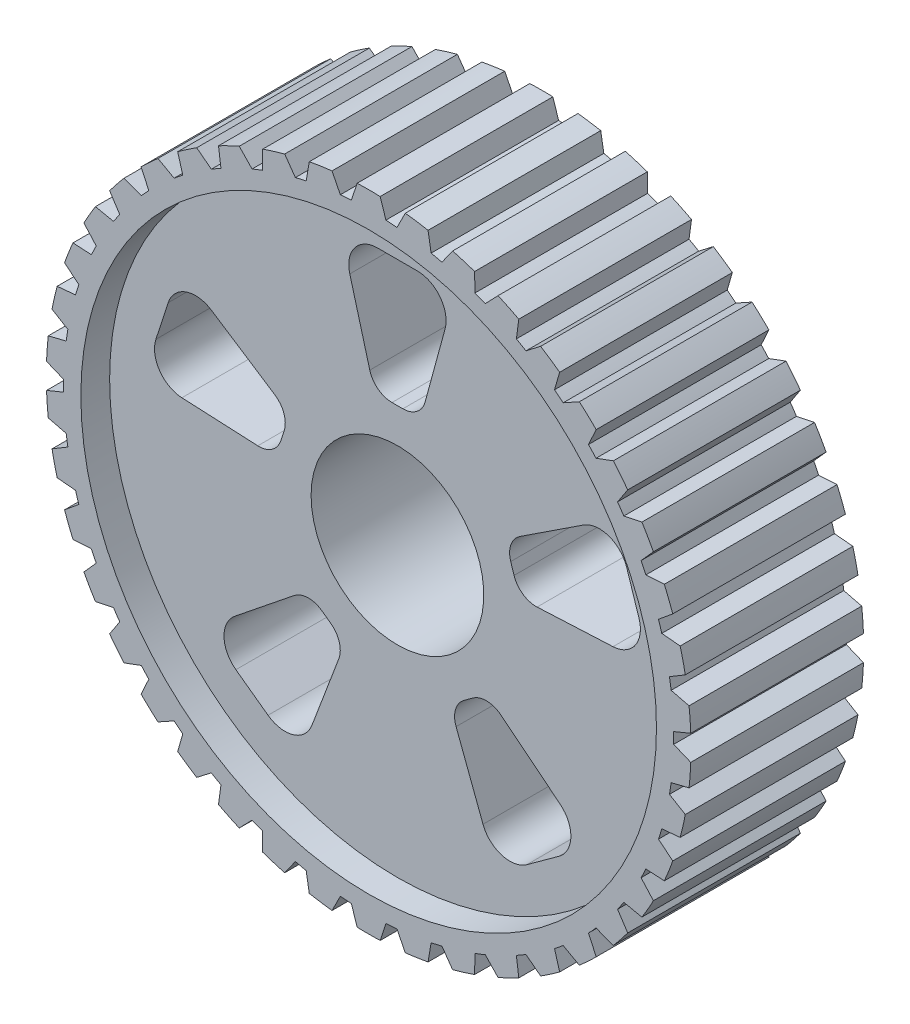
from build123d import *

# Parameters (mm, degrees)
SKETCH_1_R      = 50
EXTRUDE_1_DEPTH = 15
SKETCH_2_R      = 50
SKETCH_2_R_2    = 15
EXTRUDE_2_DEPTH = 25


with BuildPart() as part:
    # Эскиз1 → Бобышка-Вытянуть1 (new, symmetric)
    with BuildSketch(Plane.XY):
        with BuildLine():
            ThreePointArc((2, 55.964274319), (0, 56), (-2, 55.964274319))
            Line((-2, 55.964274319), (-3, 52.915026221))
            ThreePointArc((-3, 52.915026221), (-3.478337142, 52.885736931), (-3.956389894, 52.852123694))
            ThreePointArc((-3.956389894, 52.852123694), (-3.96069496, 52.851801251), (-3.965, 52.851478456))
            ThreePointArc((-3.965, 52.851478456), (-4.442723091, 52.813466195), (-4.920082944, 52.771135897))
            Line((-4.920082944, 52.771135897), (-6.363380617, 55.637284146))
            ThreePointArc((-6.363380617, 55.637284146), (-8.346366906, 55.374526269), (-10.318703922, 55.041115081))
            Line((-10.318703922, 55.041115081), (-10.853067901, 51.8768823))
            ThreePointArc((-10.853067901, 51.8768823), (-11.32169707, 51.776627695), (-11.789400575, 51.672139825))
            ThreePointArc((-11.789400575, 51.672139825), (-11.7936095, 51.671179346), (-11.797818346, 51.670218524))
            ThreePointArc((-11.797818346, 51.670218524), (-12.264540231, 51.561429896), (-12.730259365, 51.448425598))
            Line((-12.730259365, 51.448425598), (-14.584613826, 54.067448983))
            ThreePointArc((-14.584613826, 54.067448983), (-16.506289767, 53.512077124), (-18.406905049, 52.888428286))
            Line((-18.406905049, 52.888428286), (-18.4636962, 49.679894551))
            ThreePointArc((-18.4636962, 49.679894551), (-18.912148995, 49.510914154), (-19.359055529, 49.337885737))
            ThreePointArc((-19.359055529, 49.337885737), (-19.363074291, 49.336308678), (-19.367092925, 49.334731292))
            ThreePointArc((-19.367092925, 49.334731292), (-19.812387809, 49.157596456), (-20.256062829, 48.976442487))
            Line((-20.256062829, 48.976442487), (-22.480050863, 51.289836354))
            ThreePointArc((-22.480050863, 51.289836354), (-24.297489391, 50.454256603), (-26.083926334, 49.554301398))
            Line((-26.083926334, 49.554301398), (-25.661876036, 46.373140052))
            ThreePointArc((-25.661876036, 46.373140052), (-26.080134762, 46.139208606), (-26.496261172, 45.901504811))
            ThreePointArc((-26.496261172, 45.901504811), (-26.5, 45.899346401), (-26.503738652, 45.897187686))
            ThreePointArc((-26.503738652, 45.897187686), (-26.917659382, 45.655663541), (-27.32937932, 45.410406582))
            Line((-27.32937932, 45.410406582), (-29.87332071, 47.366493535))
            ThreePointArc((-29.87332071, 47.366493535), (-31.545923252, 46.269371362), (-33.178275807, 45.113213302))
            Line((-33.178275807, 45.113213302), (-32.286811966, 42.030486234))
            ThreePointArc((-32.286811966, 42.030486234), (-32.665533415, 41.73682938), (-33.041584125, 41.439760117))
            ThreePointArc((-33.041584125, 41.439760117), (-33.044959499, 41.437068571), (-33.048334653, 41.43437675))
            ThreePointArc((-33.048334653, 41.43437675), (-33.421634925, 41.133858547), (-33.792202639, 40.829977233))
            Line((-33.792202639, 40.829977233), (-36.599269937, 42.38506152))
            ThreePointArc((-36.599269937, 42.38506152), (-38.089673315, 41.050904822), (-39.531477424, 39.664370569))
            Line((-39.531477424, 39.664370569), (-38.19051387, 36.748940806))
            ThreePointArc((-38.19051387, 36.748940806), (-38.52123803, 36.402118354), (-38.848812688, 36.052319659))
            ThreePointArc((-38.848812688, 36.052319659), (-38.851749207, 36.049155102), (-38.854685469, 36.045990306))
            ThreePointArc((-38.854685469, 36.045990306), (-39.179026371, 35.693191124), (-39.50016399, 35.337473661))
            Line((-39.50016399, 35.337473661), (-42.507651952, 36.456817271))
            ThreePointArc((-42.507651952, 36.456817271), (-43.782563018, 34.915428904), (-45.001611159, 33.329491341))
            Line((-45.001611159, 33.329491341), (-43.241102801, 30.646484767))
            ThreePointArc((-43.241102801, 30.646484767), (-43.516441841, 30.254244156), (-43.788222971, 29.859529954))
            ThreePointArc((-43.788222971, 29.859529954), (-43.790655039, 29.855963077), (-43.793086816, 29.852396003))
            ThreePointArc((-43.793086816, 29.852396003), (-44.061223109, 29.455196793), (-44.32575695, 29.055589322))
            Line((-44.32575695, 29.055589322), (-47.466483264, 29.714187967))
            ThreePointArc((-47.466483264, 29.714187967), (-48.497422612, 28), (-49.466483264, 26.250086352))
            Line((-49.466483264, 26.250086352), (-47.32575695, 23.859436899))
            ThreePointArc((-47.32575695, 23.859436899), (-47.539560251, 23.430540138), (-47.74947671, 22.999727692))
            ThreePointArc((-47.74947671, 22.999727692), (-47.751349999, 22.995838173), (-47.753222971, 22.991948502))
            ThreePointArc((-47.753222971, 22.991948502), (-47.959164932, 22.559222039), (-48.161185745, 22.12465113))
            Line((-48.161185745, 22.12465113), (-51.364991776, 22.307792805))
            ThreePointArc((-51.364991776, 22.307792805), (-52.128929924, 20.459097365), (-52.826355874, 18.58429781))
            Line((-52.826355874, 18.58429781), (-50.353231891, 16.539408638))
            ThreePointArc((-50.353231891, 16.539408638), (-50.500723441, 16.083436571), (-50.644086044, 15.626149519))
            ThreePointArc((-50.644086044, 15.626149519), (-50.645358707, 15.622024244), (-50.646631033, 15.617898865))
            ThreePointArc((-50.646631033, 15.617898865), (-50.785778261, 15.159311542), (-50.920773235, 14.699484792))
            Line((-50.920773235, 14.699484792), (-54.11609125, 14.403078414))
            ThreePointArc((-54.11609125, 14.403078414), (-54.595963082, 12.461172302), (-55.006174986, 10.503366765))
            Line((-55.006174986, 10.503366765), (-52.255898839, 8.849917319))
            ThreePointArc((-52.255898839, 8.849917319), (-52.33378392, 8.377055607), (-52.407390182, 7.903508987))
            ThreePointArc((-52.407390182, 7.903508987), (-52.40803379, 7.899240107), (-52.40867705, 7.894971175))
            ThreePointArc((-52.40867705, 7.894971175), (-52.477921224, 7.420767076), (-52.542874795, 6.945956253))
            Line((-52.542874795, 6.945956253), (-55.65832667, 6.176623052))
            ThreePointArc((-55.65832667, 6.176623052), (-55.843412642, 4.184885241), (-55.957247044, 2.187807863))
            Line((-55.957247044, 2.187807863), (-52.991255357, 0.96273347))
            ThreePointArc((-52.991255357, 0.96273347), (-52.997794144, 0.483545065), (-52.999999824, 0.004317125))
            ThreePointArc((-52.999999824, 0.004317125), (-53, 0), (-52.999999824, -0.004317125))
            ThreePointArc((-52.999999824, -0.004317125), (-52.997794144, -0.483545065), (-52.991255357, -0.96273347))
            Line((-52.991255357, -0.96273347), (-55.957247044, -2.187807863))
            ThreePointArc((-55.957247044, -2.187807863), (-55.843412642, -4.184885241), (-55.65832667, -6.176623052))
            Line((-55.65832667, -6.176623052), (-52.542874795, -6.945956253))
            ThreePointArc((-52.542874795, -6.945956253), (-52.477921224, -7.420767076), (-52.40867705, -7.894971175))
            ThreePointArc((-52.40867705, -7.894971175), (-52.40803379, -7.899240107), (-52.407390182, -7.903508987))
            ThreePointArc((-52.407390182, -7.903508987), (-52.33378392, -8.377055607), (-52.255898839, -8.849917319))
            Line((-52.255898839, -8.849917319), (-55.006174986, -10.503366765))
            ThreePointArc((-55.006174986, -10.503366765), (-54.595963082, -12.461172302), (-54.11609125, -14.403078414))
            Line((-54.11609125, -14.403078414), (-50.920773235, -14.699484792))
            ThreePointArc((-50.920773235, -14.699484792), (-50.785778261, -15.159311542), (-50.646631033, -15.617898865))
            ThreePointArc((-50.646631033, -15.617898865), (-50.645358707, -15.622024244), (-50.644086044, -15.626149519))
            ThreePointArc((-50.644086044, -15.626149519), (-50.500723441, -16.083436571), (-50.353231891, -16.539408638))
            Line((-50.353231891, -16.539408638), (-52.826355874, -18.58429781))
            ThreePointArc((-52.826355874, -18.58429781), (-52.128929924, -20.459097365), (-51.364991776, -22.307792805))
            Line((-51.364991776, -22.307792805), (-48.161185745, -22.12465113))
            ThreePointArc((-48.161185745, -22.12465113), (-47.959164932, -22.559222039), (-47.753222971, -22.991948502))
            ThreePointArc((-47.753222971, -22.991948502), (-47.751349999, -22.995838173), (-47.74947671, -22.999727692))
            ThreePointArc((-47.74947671, -22.999727692), (-47.539560251, -23.430540138), (-47.32575695, -23.859436899))
            Line((-47.32575695, -23.859436899), (-49.466483264, -26.250086352))
            ThreePointArc((-49.466483264, -26.250086352), (-48.497422612, -28), (-47.466483264, -29.714187967))
            Line((-47.466483264, -29.714187967), (-44.32575695, -29.055589322))
            ThreePointArc((-44.32575695, -29.055589322), (-44.061223109, -29.455196793), (-43.793086816, -29.852396003))
            ThreePointArc((-43.793086816, -29.852396003), (-43.790655039, -29.855963077), (-43.788222971, -29.859529954))
            ThreePointArc((-43.788222971, -29.859529954), (-43.516441841, -30.254244156), (-43.241102801, -30.646484767))
            Line((-43.241102801, -30.646484767), (-45.001611159, -33.329491341))
            ThreePointArc((-45.001611159, -33.329491341), (-43.782563018, -34.915428904), (-42.507651952, -36.456817271))
            Line((-42.507651952, -36.456817271), (-39.50016399, -35.337473661))
            ThreePointArc((-39.50016399, -35.337473661), (-39.179026371, -35.693191124), (-38.854685469, -36.045990306))
            ThreePointArc((-38.854685469, -36.045990306), (-38.851749207, -36.049155102), (-38.848812688, -36.052319659))
            ThreePointArc((-38.848812688, -36.052319659), (-38.52123803, -36.402118354), (-38.19051387, -36.748940806))
            Line((-38.19051387, -36.748940806), (-39.531477424, -39.664370569))
            ThreePointArc((-39.531477424, -39.664370569), (-38.089673315, -41.050904822), (-36.599269937, -42.38506152))
            Line((-36.599269937, -42.38506152), (-33.792202639, -40.829977233))
            ThreePointArc((-33.792202639, -40.829977233), (-33.421634925, -41.133858547), (-33.048334653, -41.43437675))
            ThreePointArc((-33.048334653, -41.43437675), (-33.044959499, -41.437068571), (-33.041584125, -41.439760117))
            ThreePointArc((-33.041584125, -41.439760117), (-32.665533415, -41.73682938), (-32.286811966, -42.030486234))
            Line((-32.286811966, -42.030486234), (-33.178275807, -45.113213302))
            ThreePointArc((-33.178275807, -45.113213302), (-31.545923252, -46.269371362), (-29.87332071, -47.366493535))
            Line((-29.87332071, -47.366493535), (-27.32937932, -45.410406582))
            ThreePointArc((-27.32937932, -45.410406582), (-26.917659382, -45.655663541), (-26.503738652, -45.897187686))
            ThreePointArc((-26.503738652, -45.897187686), (-26.5, -45.899346401), (-26.496261172, -45.901504811))
            ThreePointArc((-26.496261172, -45.901504811), (-26.080134762, -46.139208606), (-25.661876036, -46.373140052))
            Line((-25.661876036, -46.373140052), (-26.083926334, -49.554301398))
            ThreePointArc((-26.083926334, -49.554301398), (-24.297489391, -50.454256603), (-22.480050863, -51.289836354))
            Line((-22.480050863, -51.289836354), (-20.256062829, -48.976442487))
            ThreePointArc((-20.256062829, -48.976442487), (-19.812387809, -49.157596456), (-19.367092925, -49.334731292))
            ThreePointArc((-19.367092925, -49.334731292), (-19.363074291, -49.336308678), (-19.359055529, -49.337885737))
            ThreePointArc((-19.359055529, -49.337885737), (-18.912148995, -49.510914154), (-18.4636962, -49.679894551))
            Line((-18.4636962, -49.679894551), (-18.406905049, -52.888428286))
            ThreePointArc((-18.406905049, -52.888428286), (-16.506289767, -53.512077124), (-14.584613826, -54.067448983))
            Line((-14.584613826, -54.067448983), (-12.730259365, -51.448425598))
            ThreePointArc((-12.730259365, -51.448425598), (-12.264540231, -51.561429896), (-11.797818346, -51.670218524))
            ThreePointArc((-11.797818346, -51.670218524), (-11.7936095, -51.671179346), (-11.789400575, -51.672139825))
            ThreePointArc((-11.789400575, -51.672139825), (-11.32169707, -51.776627695), (-10.853067901, -51.8768823))
            Line((-10.853067901, -51.8768823), (-10.318703922, -55.041115081))
            ThreePointArc((-10.318703922, -55.041115081), (-8.346366906, -55.374526269), (-6.363380617, -55.637284146))
            Line((-6.363380617, -55.637284146), (-4.920082944, -52.771135897))
            ThreePointArc((-4.920082944, -52.771135897), (-4.442723091, -52.813466195), (-3.965, -52.851478456))
            ThreePointArc((-3.965, -52.851478456), (-3.96069496, -52.851801251), (-3.956389894, -52.852123694))
            ThreePointArc((-3.956389894, -52.852123694), (-3.478337142, -52.885736931), (-3, -52.915026221))
            Line((-3, -52.915026221), (-2, -55.964274319))
            ThreePointArc((-2, -55.964274319), (0, -56), (2, -55.964274319))
            Line((2, -55.964274319), (3, -52.915026221))
            ThreePointArc((3, -52.915026221), (3.478337142, -52.885736931), (3.956389894, -52.852123694))
            ThreePointArc((3.956389894, -52.852123694), (3.96069496, -52.851801251), (3.965, -52.851478456))
            ThreePointArc((3.965, -52.851478456), (4.442723091, -52.813466195), (4.920082944, -52.771135897))
            Line((4.920082944, -52.771135897), (6.363380617, -55.637284146))
            ThreePointArc((6.363380617, -55.637284146), (8.346366906, -55.374526269), (10.318703922, -55.041115081))
            Line((10.318703922, -55.041115081), (10.853067901, -51.8768823))
            ThreePointArc((10.853067901, -51.8768823), (11.32169707, -51.776627695), (11.789400575, -51.672139825))
            ThreePointArc((11.789400575, -51.672139825), (11.7936095, -51.671179346), (11.797818346, -51.670218524))
            ThreePointArc((11.797818346, -51.670218524), (12.264540231, -51.561429896), (12.730259365, -51.448425598))
            Line((12.730259365, -51.448425598), (14.584613826, -54.067448983))
            ThreePointArc((14.584613826, -54.067448983), (16.506289767, -53.512077124), (18.406905049, -52.888428286))
            Line((18.406905049, -52.888428286), (18.4636962, -49.679894551))
            ThreePointArc((18.4636962, -49.679894551), (18.912148995, -49.510914154), (19.359055529, -49.337885737))
            ThreePointArc((19.359055529, -49.337885737), (19.363074291, -49.336308678), (19.367092925, -49.334731292))
            ThreePointArc((19.367092925, -49.334731292), (19.812387809, -49.157596456), (20.256062829, -48.976442487))
            Line((20.256062829, -48.976442487), (22.480050863, -51.289836354))
            ThreePointArc((22.480050863, -51.289836354), (24.297489391, -50.454256603), (26.083926334, -49.554301398))
            Line((26.083926334, -49.554301398), (25.661876036, -46.373140052))
            ThreePointArc((25.661876036, -46.373140052), (26.080134762, -46.139208606), (26.496261172, -45.901504811))
            ThreePointArc((26.496261172, -45.901504811), (26.5, -45.899346401), (26.503738652, -45.897187686))
            ThreePointArc((26.503738652, -45.897187686), (26.917659382, -45.655663541), (27.32937932, -45.410406582))
            Line((27.32937932, -45.410406582), (29.87332071, -47.366493535))
            ThreePointArc((29.87332071, -47.366493535), (31.545923252, -46.269371362), (33.178275807, -45.113213302))
            Line((33.178275807, -45.113213302), (32.286811966, -42.030486234))
            ThreePointArc((32.286811966, -42.030486234), (32.665533415, -41.73682938), (33.041584125, -41.439760117))
            ThreePointArc((33.041584125, -41.439760117), (33.044959499, -41.437068571), (33.048334653, -41.43437675))
            ThreePointArc((33.048334653, -41.43437675), (33.421634925, -41.133858547), (33.792202639, -40.829977233))
            Line((33.792202639, -40.829977233), (36.599269937, -42.38506152))
            ThreePointArc((36.599269937, -42.38506152), (38.089673315, -41.050904822), (39.531477424, -39.664370569))
            Line((39.531477424, -39.664370569), (38.19051387, -36.748940806))
            ThreePointArc((38.19051387, -36.748940806), (38.52123803, -36.402118354), (38.848812688, -36.052319659))
            ThreePointArc((38.848812688, -36.052319659), (38.851749207, -36.049155102), (38.854685469, -36.045990306))
            ThreePointArc((38.854685469, -36.045990306), (39.179026371, -35.693191124), (39.50016399, -35.337473661))
            Line((39.50016399, -35.337473661), (42.507651952, -36.456817271))
            ThreePointArc((42.507651952, -36.456817271), (43.782563018, -34.915428904), (45.001611159, -33.329491341))
            Line((45.001611159, -33.329491341), (43.241102801, -30.646484767))
            ThreePointArc((43.241102801, -30.646484767), (43.516441841, -30.254244156), (43.788222971, -29.859529954))
            ThreePointArc((43.788222971, -29.859529954), (43.790655039, -29.855963077), (43.793086816, -29.852396003))
            ThreePointArc((43.793086816, -29.852396003), (44.061223109, -29.455196793), (44.32575695, -29.055589322))
            Line((44.32575695, -29.055589322), (47.466483264, -29.714187967))
            ThreePointArc((47.466483264, -29.714187967), (48.497422612, -28), (49.466483264, -26.250086352))
            Line((49.466483264, -26.250086352), (47.32575695, -23.859436899))
            ThreePointArc((47.32575695, -23.859436899), (47.539560251, -23.430540138), (47.74947671, -22.999727692))
            ThreePointArc((47.74947671, -22.999727692), (47.751349999, -22.995838173), (47.753222971, -22.991948502))
            ThreePointArc((47.753222971, -22.991948502), (47.959164932, -22.559222039), (48.161185745, -22.12465113))
            Line((48.161185745, -22.12465113), (51.364991776, -22.307792805))
            ThreePointArc((51.364991776, -22.307792805), (52.128929924, -20.459097365), (52.826355874, -18.58429781))
            Line((52.826355874, -18.58429781), (50.353231891, -16.539408638))
            ThreePointArc((50.353231891, -16.539408638), (50.500723441, -16.083436571), (50.644086044, -15.626149519))
            ThreePointArc((50.644086044, -15.626149519), (50.645358707, -15.622024244), (50.646631033, -15.617898865))
            ThreePointArc((50.646631033, -15.617898865), (50.785778261, -15.159311542), (50.920773235, -14.699484792))
            Line((50.920773235, -14.699484792), (54.11609125, -14.403078414))
            ThreePointArc((54.11609125, -14.403078414), (54.595963082, -12.461172302), (55.006174986, -10.503366765))
            Line((55.006174986, -10.503366765), (52.255898839, -8.849917319))
            ThreePointArc((52.255898839, -8.849917319), (52.33378392, -8.377055607), (52.407390182, -7.903508987))
            ThreePointArc((52.407390182, -7.903508987), (52.40803379, -7.899240107), (52.40867705, -7.894971175))
            ThreePointArc((52.40867705, -7.894971175), (52.477921224, -7.420767076), (52.542874795, -6.945956253))
            Line((52.542874795, -6.945956253), (55.65832667, -6.176623052))
            ThreePointArc((55.65832667, -6.176623052), (55.843412642, -4.184885241), (55.957247044, -2.187807863))
            Line((55.957247044, -2.187807863), (52.991255357, -0.96273347))
            ThreePointArc((52.991255357, -0.96273347), (52.997794144, -0.483545065), (52.999999824, -0.004317125))
            ThreePointArc((52.999999824, -0.004317125), (53, 0), (52.999999824, 0.004317125))
            ThreePointArc((52.999999824, 0.004317125), (52.997794144, 0.483545065), (52.991255357, 0.96273347))
            Line((52.991255357, 0.96273347), (55.957247044, 2.187807863))
            ThreePointArc((55.957247044, 2.187807863), (55.843412642, 4.184885241), (55.65832667, 6.176623052))
            Line((55.65832667, 6.176623052), (52.542874795, 6.945956253))
            ThreePointArc((52.542874795, 6.945956253), (52.477921224, 7.420767076), (52.40867705, 7.894971175))
            ThreePointArc((52.40867705, 7.894971175), (52.40803379, 7.899240107), (52.407390182, 7.903508987))
            ThreePointArc((52.407390182, 7.903508987), (52.33378392, 8.377055607), (52.255898839, 8.849917319))
            Line((52.255898839, 8.849917319), (55.006174986, 10.503366765))
            ThreePointArc((55.006174986, 10.503366765), (54.595963082, 12.461172302), (54.11609125, 14.403078414))
            Line((54.11609125, 14.403078414), (50.920773235, 14.699484792))
            ThreePointArc((50.920773235, 14.699484792), (50.785778261, 15.159311542), (50.646631033, 15.617898865))
            ThreePointArc((50.646631033, 15.617898865), (50.645358707, 15.622024244), (50.644086044, 15.626149519))
            ThreePointArc((50.644086044, 15.626149519), (50.500723441, 16.083436571), (50.353231891, 16.539408638))
            Line((50.353231891, 16.539408638), (52.826355874, 18.58429781))
            ThreePointArc((52.826355874, 18.58429781), (52.128929924, 20.459097365), (51.364991776, 22.307792805))
            Line((51.364991776, 22.307792805), (48.161185745, 22.12465113))
            ThreePointArc((48.161185745, 22.12465113), (47.959164932, 22.559222039), (47.753222971, 22.991948502))
            ThreePointArc((47.753222971, 22.991948502), (47.751349999, 22.995838173), (47.74947671, 22.999727692))
            ThreePointArc((47.74947671, 22.999727692), (47.539560251, 23.430540138), (47.32575695, 23.859436899))
            Line((47.32575695, 23.859436899), (49.466483264, 26.250086352))
            ThreePointArc((49.466483264, 26.250086352), (48.497422612, 28), (47.466483264, 29.714187967))
            Line((47.466483264, 29.714187967), (44.32575695, 29.055589322))
            ThreePointArc((44.32575695, 29.055589322), (44.061223109, 29.455196793), (43.793086816, 29.852396003))
            ThreePointArc((43.793086816, 29.852396003), (43.790655039, 29.855963077), (43.788222971, 29.859529954))
            ThreePointArc((43.788222971, 29.859529954), (43.516441841, 30.254244156), (43.241102801, 30.646484767))
            Line((43.241102801, 30.646484767), (45.001611159, 33.329491341))
            ThreePointArc((45.001611159, 33.329491341), (43.782563018, 34.915428904), (42.507651952, 36.456817271))
            Line((42.507651952, 36.456817271), (39.50016399, 35.337473661))
            ThreePointArc((39.50016399, 35.337473661), (39.179026371, 35.693191124), (38.854685469, 36.045990306))
            ThreePointArc((38.854685469, 36.045990306), (38.851749207, 36.049155102), (38.848812688, 36.052319659))
            ThreePointArc((38.848812688, 36.052319659), (38.52123803, 36.402118354), (38.19051387, 36.748940806))
            Line((38.19051387, 36.748940806), (39.531477424, 39.664370569))
            ThreePointArc((39.531477424, 39.664370569), (38.089673315, 41.050904822), (36.599269937, 42.38506152))
            Line((36.599269937, 42.38506152), (33.792202639, 40.829977233))
            ThreePointArc((33.792202639, 40.829977233), (33.421634925, 41.133858547), (33.048334653, 41.43437675))
            ThreePointArc((33.048334653, 41.43437675), (33.044959499, 41.437068571), (33.041584125, 41.439760117))
            ThreePointArc((33.041584125, 41.439760117), (32.665533415, 41.73682938), (32.286811966, 42.030486234))
            Line((32.286811966, 42.030486234), (33.178275807, 45.113213302))
            ThreePointArc((33.178275807, 45.113213302), (31.545923252, 46.269371362), (29.87332071, 47.366493535))
            Line((29.87332071, 47.366493535), (27.32937932, 45.410406582))
            ThreePointArc((27.32937932, 45.410406582), (26.917659382, 45.655663541), (26.503738652, 45.897187686))
            ThreePointArc((26.503738652, 45.897187686), (26.5, 45.899346401), (26.496261172, 45.901504811))
            ThreePointArc((26.496261172, 45.901504811), (26.080134762, 46.139208606), (25.661876036, 46.373140052))
            Line((25.661876036, 46.373140052), (26.083926334, 49.554301398))
            ThreePointArc((26.083926334, 49.554301398), (24.297489391, 50.454256603), (22.480050863, 51.289836354))
            Line((22.480050863, 51.289836354), (20.256062829, 48.976442487))
            ThreePointArc((20.256062829, 48.976442487), (19.812387809, 49.157596456), (19.367092925, 49.334731292))
            ThreePointArc((19.367092925, 49.334731292), (19.363074291, 49.336308678), (19.359055529, 49.337885737))
            ThreePointArc((19.359055529, 49.337885737), (18.912148995, 49.510914154), (18.4636962, 49.679894551))
            Line((18.4636962, 49.679894551), (18.406905049, 52.888428286))
            ThreePointArc((18.406905049, 52.888428286), (16.506289767, 53.512077124), (14.584613826, 54.067448983))
            Line((14.584613826, 54.067448983), (12.730259365, 51.448425598))
            ThreePointArc((12.730259365, 51.448425598), (12.264540231, 51.561429896), (11.797818346, 51.670218524))
            ThreePointArc((11.797818346, 51.670218524), (11.7936095, 51.671179346), (11.789400575, 51.672139825))
            ThreePointArc((11.789400575, 51.672139825), (11.32169707, 51.776627695), (10.853067901, 51.8768823))
            Line((10.853067901, 51.8768823), (10.318703922, 55.041115081))
            ThreePointArc((10.318703922, 55.041115081), (8.346366906, 55.374526269), (6.363380617, 55.637284146))
            Line((6.363380617, 55.637284146), (4.920082944, 52.771135897))
            ThreePointArc((4.920082944, 52.771135897), (4.442723091, 52.813466195), (3.965, 52.851478456))
            ThreePointArc((3.965, 52.851478456), (3.96069496, 52.851801251), (3.956389894, 52.852123694))
            ThreePointArc((3.956389894, 52.852123694), (3.478337142, 52.885736931), (3, 52.915026221))
            Line((3, 52.915026221), (2, 55.964274319))
        make_face()
        Circle(SKETCH_1_R, mode=Mode.SUBTRACT)
    extrude(amount=EXTRUDE_1_DEPTH, both=True)

    # Эскиз2 → Бобышка-Вытянуть2 (add)
    with BuildSketch(Plane(origin=(0, 0, -15), x_dir=(-1, 0, 0), z_dir=(0, 0, -1))):
        Circle(SKETCH_2_R)
        Circle(SKETCH_2_R_2, mode=Mode.SUBTRACT)
        with BuildLine():
            Line((3.453748068, 43), (-3.453748068, 43))
            ThreePointArc((-3.453748068, 43), (-7.427281454, 41.034968275), (-8.277567174, 36.684412971))
            Line((-8.277567174, 36.684412971), (-4.803871921, 23.947530377))
            ThreePointArc((-4.803871921, 23.947530377), (-3.372791256, 21.821173291), (-0.944816636, 21))
            Line((-0.944816636, 21), (0.944816636, 21))
            ThreePointArc((0.944816636, 21), (3.372791256, 21.821173291), (4.803871921, 23.947530377))
            Line((4.803871921, 23.947530377), (8.277567174, 36.684412971))
            ThreePointArc((8.277567174, 36.684412971), (7.427281454, 41.034968275), (3.453748068, 43))
        make_face(mode=Mode.SUBTRACT)
        with BuildLine():
            Line((41.962697048, 10.003021153), (39.828163353, 16.572440364))
            ThreePointArc((39.828163353, 16.572440364), (36.731417782, 19.744266986), (32.331041074, 19.208541237))
            Line((32.331041074, 19.208541237), (21.290976752, 11.968947554))
            ThreePointArc((21.290976752, 11.968947554), (19.710919235, 9.950828486), (19.680222445, 7.3879309))
            Line((19.680222445, 7.3879309), (20.264151239, 5.590782863))
            ThreePointArc((20.264151239, 5.590782863), (21.795418868, 3.535398282), (24.259932876, 2.831440166))
            Line((24.259932876, 2.831440166), (37.446858931, 3.463672837))
            ThreePointArc((37.446858931, 3.463672837), (41.321730165, 5.616738135), (41.962697048, 10.003021153))
        make_face(mode=Mode.SUBTRACT)
        with BuildLine():
            Line((22.480624967, -36.817792937), (28.06890673, -32.757668579))
            ThreePointArc((28.06890673, -32.757668579), (30.128546098, -28.832340194), (28.259249449, -24.812881613))
            Line((28.259249449, -24.812881613), (17.962419207, -16.550313979))
            ThreePointArc((17.962419207, -16.550313979), (15.554809292, -15.67122307), (13.107863013, -16.434007597))
            Line((13.107863013, -16.434007597), (11.579117583, -17.544706167))
            ThreePointArc((11.579117583, -17.544706167), (10.097518404, -19.636176989), (10.189591161, -22.197604117))
            Line((10.189591161, -22.197604117), (14.865864418, -34.543745432))
            ThreePointArc((14.865864418, -34.543745432), (18.110952262, -37.563633201), (22.480624967, -36.817792937))
        make_face(mode=Mode.SUBTRACT)
        with BuildLine():
            Line((-28.06890673, -32.757668579), (-22.480624967, -36.817792937))
            ThreePointArc((-22.480624967, -36.817792937), (-18.110952262, -37.563633201), (-14.865864418, -34.543745432))
            Line((-14.865864418, -34.543745432), (-10.189591161, -22.197604117))
            ThreePointArc((-10.189591161, -22.197604117), (-10.097518404, -19.636176989), (-11.579117583, -17.544706167))
            Line((-11.579117583, -17.544706167), (-13.107863013, -16.434007597))
            ThreePointArc((-13.107863013, -16.434007597), (-15.554809292, -15.67122307), (-17.962419207, -16.550313979))
            Line((-17.962419207, -16.550313979), (-28.259249449, -24.812881613))
            ThreePointArc((-28.259249449, -24.812881613), (-30.128546098, -28.832340194), (-28.06890673, -32.757668579))
        make_face(mode=Mode.SUBTRACT)
        with BuildLine():
            Line((-39.828163353, 16.572440364), (-41.962697048, 10.003021153))
            ThreePointArc((-41.962697048, 10.003021153), (-41.321730165, 5.616738135), (-37.446858931, 3.463672837))
            Line((-37.446858931, 3.463672837), (-24.259932876, 2.831440166))
            ThreePointArc((-24.259932876, 2.831440166), (-21.795418868, 3.535398282), (-20.264151239, 5.590782863))
            Line((-20.264151239, 5.590782863), (-19.680222445, 7.3879309))
            ThreePointArc((-19.680222445, 7.3879309), (-19.710919235, 9.950828486), (-21.290976752, 11.968947554))
            Line((-21.290976752, 11.968947554), (-32.331041074, 19.208541237))
            ThreePointArc((-32.331041074, 19.208541237), (-36.731417782, 19.744266986), (-39.828163353, 16.572440364))
        make_face(mode=Mode.SUBTRACT)
    extrude(amount=-EXTRUDE_2_DEPTH)


solid = part.part
